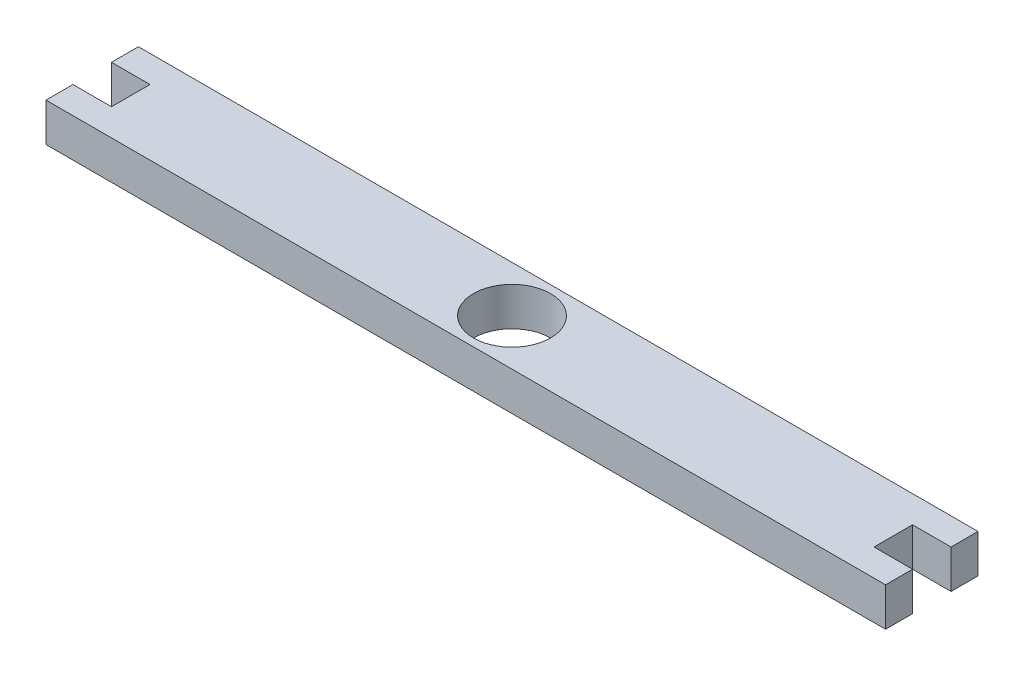
from build123d import *

# Parameters (mm, degrees)
SKETCH1_W           = 109
SKETCH1_H           = 12
BOSS_EXTRUDE1_DEPTH = 5
SKETCH2_R           = 5
CUT_EXTRUDE2_DEPTH  = 56.056788864
CUT_EXTRUDE3_DEPTH  = 56.056788864


with BuildPart() as part:
    # Sketch1 → Boss-Extrude1 (new body)
    with BuildSketch(Plane(origin=(0, 0, 0), x_dir=(1, 0, 0), z_dir=(0, 1, 0))):
        Rectangle(SKETCH1_W, SKETCH1_H)
    extrude(amount=BOSS_EXTRUDE1_DEPTH)

    # Sketch2 → Cut-Extrude2 (cut, through all)
    with BuildSketch(Plane(origin=(0, 5, 0), x_dir=(1, 0, 0), z_dir=(0, 1, 0))):
        with Locations(Location((0, 0, 0), (0, 0, 270))):
            Circle(SKETCH2_R)
    extrude(amount=-CUT_EXTRUDE2_DEPTH, mode=Mode.SUBTRACT)

    # Sketch3 → Cut-Extrude3 (cut, through all)
    with BuildSketch(Plane(origin=(0, 5, 0), x_dir=(1, 0, 0), z_dir=(0, 1, 0))):
        Polygon((-54.5, 0), (-54.5, 2.5), (-49.5, 2.5), (-49.5, -2.5), (-54.5, -2.5), align=None)
    cut_extrude3 = extrude(amount=-CUT_EXTRUDE3_DEPTH, mode=Mode.SUBTRACT)

    # Mirror1: Cut-Extrude3 across plane
    add(cut_extrude3.mirror(Plane(origin=(0, 0, 0), x_dir=(0, 0, 1), z_dir=(1, 0, 0))), mode=Mode.SUBTRACT)


solid = part.part
